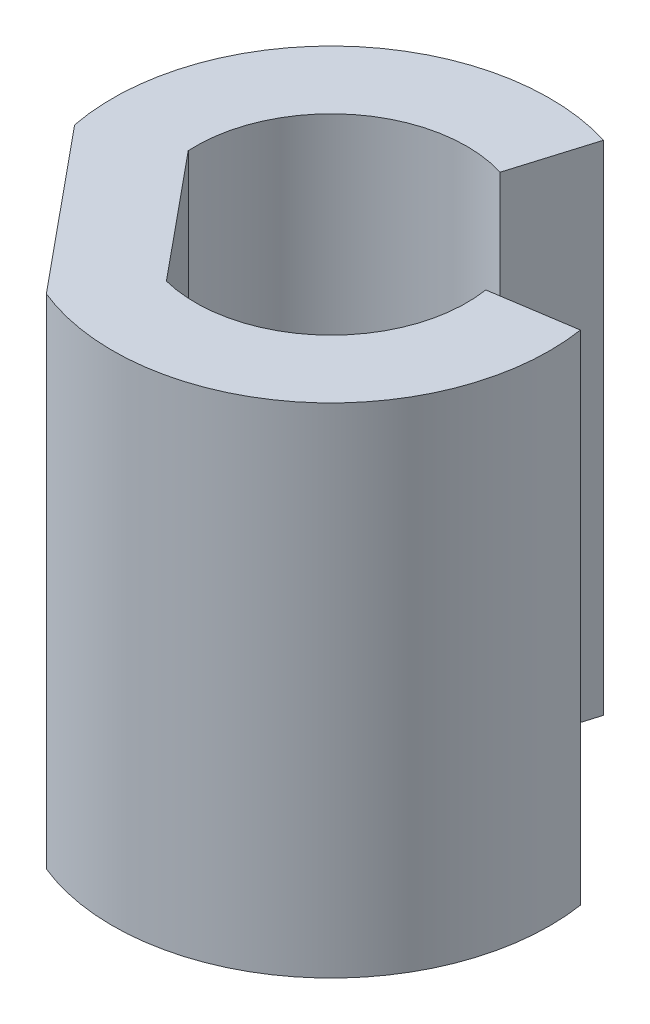
from build123d import *

# Parameters (mm, degrees)
BOSS_EXTRUDE1_DEPTH = 9


with BuildPart() as part:
    # Sketch1 → Boss-Extrude1 (new body)
    with BuildSketch(Plane(origin=(0, 0, 0), x_dir=(1, 0, 0), z_dir=(0, 1, 0))):
        with BuildLine():
            Line((-0.6024744, -2.374768325), (-2.446204679, -0.136318268))
            ThreePointArc((-2.446204679, -0.136318268), (-1.51475075, 1.925624617), (0.708554004, 2.345304079))
            Line((0.708554004, 2.345304079), (1.142362578, 3.781204536))
            ThreePointArc((1.142362578, 3.781204536), (-2.650068291, 2.929101919), (-3.876317438, -0.759383379))
            Line((-3.876317438, -0.759383379), (-1.48799963, -3.659010399))
            ThreePointArc((-1.48799963, -3.659010399), (2.448364361, -3.099679332), (3.904146056, 0.600119631))
            Line((3.904146056, 0.600119631), (2.421558946, 0.3722261))
            ThreePointArc((2.421558946, 0.3722261), (1.647349914, -1.813487871), (-0.6024744, -2.374768325))
        make_face()
    extrude(amount=BOSS_EXTRUDE1_DEPTH)


solid = part.part
